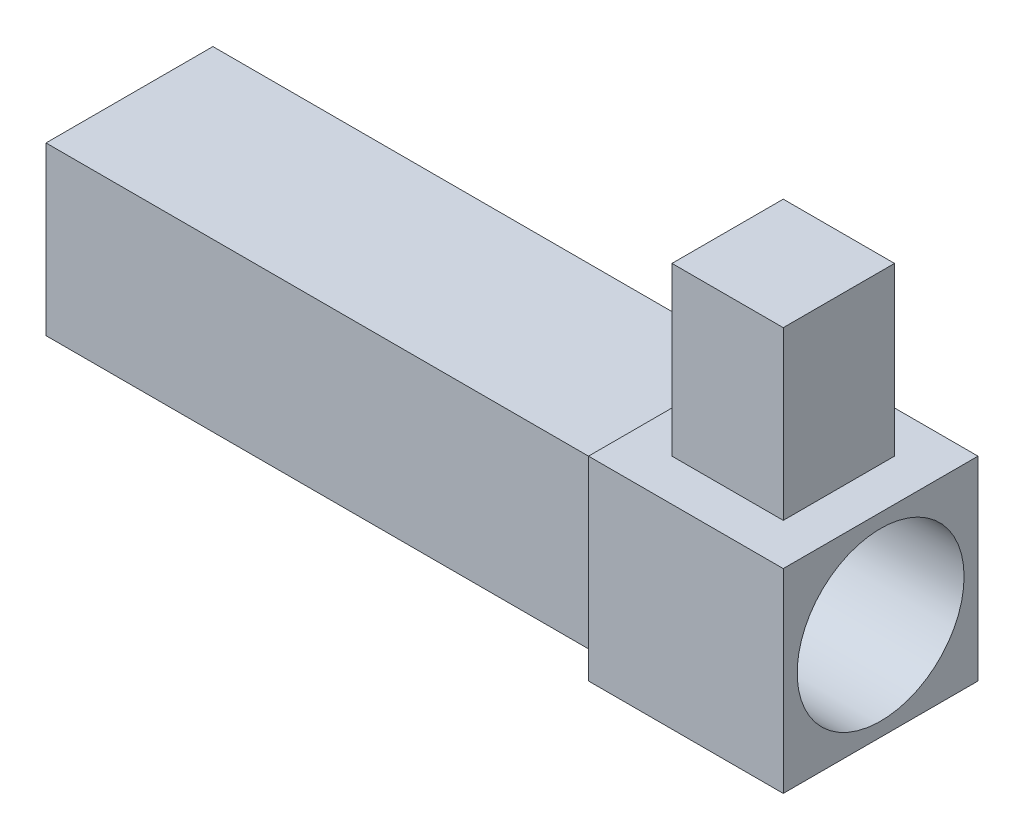
from build123d import *

# Parameters (mm, degrees)
SKETCH1_W           = 30
SKETCH1_H           = 30
BOSS_EXTRUDE1_DEPTH = 100
SKETCH2_W           = 35
SKETCH2_H           = 35
BOSS_EXTRUDE2_DEPTH = 35
SKETCH3_R           = 15
CUT_EXTRUDE1_DEPTH  = 30
SKETCH4_W           = 20
SKETCH4_H           = 20
BOSS_EXTRUDE3_DEPTH = 30


with BuildPart() as part:
    # Sketch1 → Boss-Extrude1 (new body)
    with BuildSketch(Plane(origin=(0, 0, 0), x_dir=(0, 0, -1), z_dir=(1, 0, 0))):
        Rectangle(SKETCH1_W, SKETCH1_H)
    extrude(amount=BOSS_EXTRUDE1_DEPTH)

    # Sketch2 → Boss-Extrude2 (add)
    with BuildSketch(Plane(origin=(100, 0, 0), x_dir=(0, 0, -1), z_dir=(1, 0, 0))):
        Rectangle(SKETCH2_W, SKETCH2_H)
    extrude(amount=BOSS_EXTRUDE2_DEPTH)

    # Sketch3 → Cut-Extrude1 (cut)
    with BuildSketch(Plane(origin=(135, 0, 0), x_dir=(0, 0, -1), z_dir=(1, 0, 0))):
        Circle(SKETCH3_R)
    extrude(amount=-CUT_EXTRUDE1_DEPTH, mode=Mode.SUBTRACT)

    # Sketch4 → Boss-Extrude3 (add)
    with BuildSketch(Plane(origin=(0, 17.5, 0), x_dir=(1, 0, 0), z_dir=(0, 1, 0))):
        with Locations((117.5, 0)):
            Rectangle(SKETCH4_W, SKETCH4_H)
    extrude(amount=BOSS_EXTRUDE3_DEPTH)


solid = part.part
